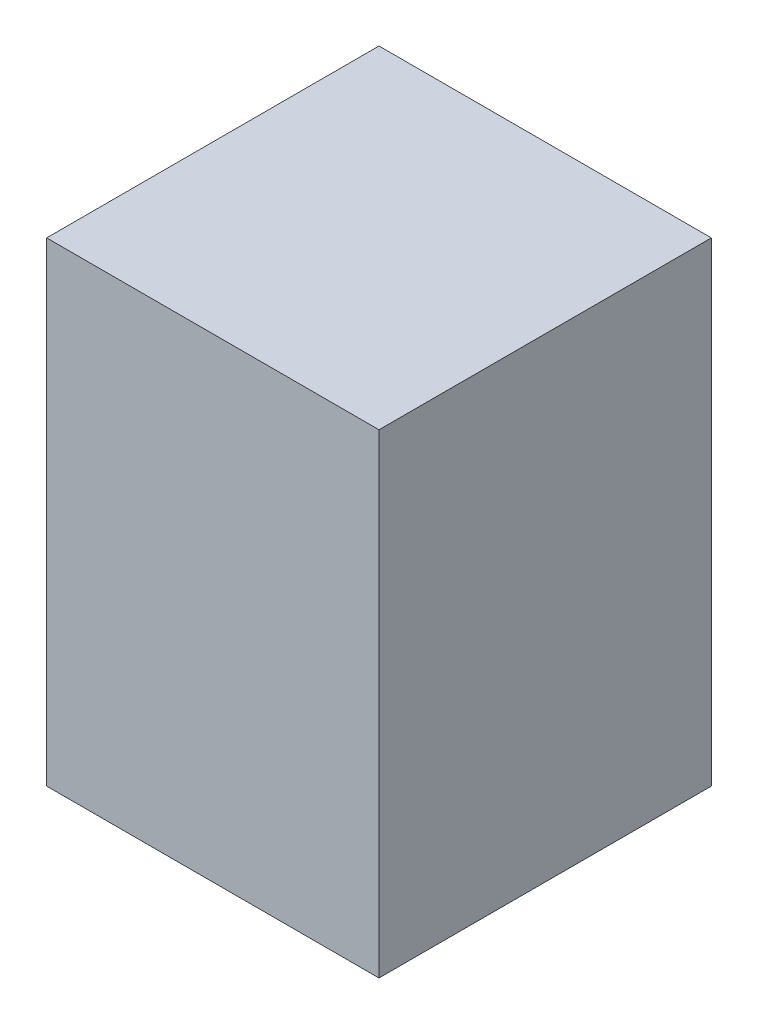
from build123d import *

# Parameters (mm, degrees)
SKETCH_1_W      = 350
SKETCH_1_H      = 500
EXTRUDE_1_DEPTH = 350


with BuildPart() as part:
    # 草圖1 → 填料-伸長1 (new body)
    with BuildSketch(Plane.XY):
        with Locations((-14688.839285714, 9031.25)):
            Rectangle(SKETCH_1_W, SKETCH_1_H)
    extrude(amount=EXTRUDE_1_DEPTH)


solid = part.part
